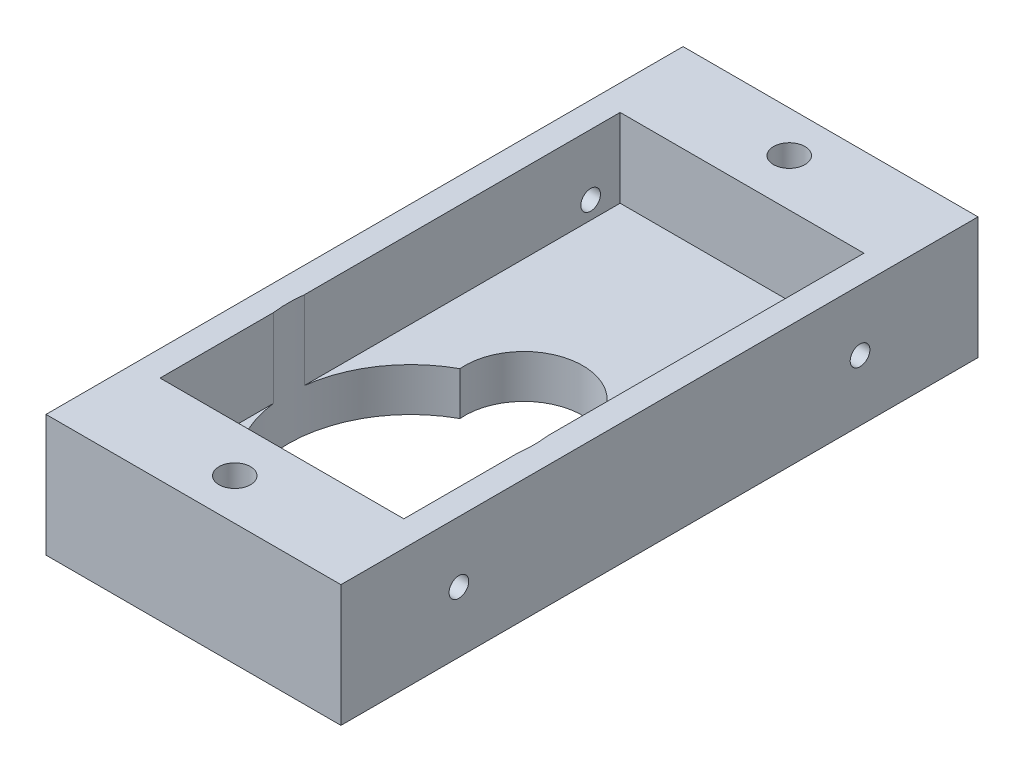
from build123d import *
from build123d.topology import SkipClean

# Parameters (mm, degrees)
SKETCH_1_W          = 15
SKETCH_1_H          = 32.4
SKETCH_1_R          = 0.8
EXTRUDE_1_DEPTH     = 2.2
SKETCH_1_3_R        = 6.25
SKETCH_1_3_R_2      = 3
CUT_EXTRUDE_1_DEPTH = 36.771497033
SKETCH_2_W          = 15
SKETCH_2_H          = 32.4
EXTRUDE_2_DEPTH     = 4
SKETCH_3_R          = 0.8
CUT_EXTRUDE_2_DEPTH = 3
SKETCH_4_R          = 0.5
CUT_EXTRUDE_3_DEPTH = 37.238101496


with BuildPart() as part:
    # 草图1 → 凸台-拉伸1 (new body)
    with BuildSketch(Plane(origin=(0, 0, 0), x_dir=(1, 0, 0), z_dir=(0, 1, 0))):
        with Locations((7.5, -16.2)):
            Rectangle(SKETCH_1_W, SKETCH_1_H)
        with Locations((3, -3)):
            Circle(SKETCH_1_R, mode=Mode.SUBTRACT)
        with Locations((12, -3)):
            Circle(SKETCH_1_R, mode=Mode.SUBTRACT)
        with Locations((3, -29.4)):
            Circle(SKETCH_1_R, mode=Mode.SUBTRACT)
        with Locations((12, -29.4)):
            Circle(SKETCH_1_R, mode=Mode.SUBTRACT)
    extrude(amount=EXTRUDE_1_DEPTH)

    # 草图1<3> → 切除-拉伸1 (cut, through all)
    with BuildSketch(Plane(origin=(0, 0, 0), x_dir=(1, 0, 0), z_dir=(0, 1, 0))):
        with Locations((7.5, -21.35)):
            Circle(SKETCH_1_3_R)
        with Locations((7.5, -15.6)):
            Circle(SKETCH_1_3_R_2)
    extrude(amount=CUT_EXTRUDE_1_DEPTH, mode=Mode.SUBTRACT)

    # 草图2 → 凸台-拉伸2 (add)
    with SkipClean():  # the faces are left unmerged after this step: merging them gives an invalid solid
        with BuildSketch(Plane(origin=(0, 2.2, 0), x_dir=(1, 0, 0), z_dir=(0, 1, 0))):
            with Locations((7.5, -16.2)):
                Rectangle(SKETCH_2_W, SKETCH_2_H)
            with BuildLine():
                Line((13.7, -27.9), (1.3, -27.9))
                Line((1.3, -27.9), (1.3, -22.138986692))
                ThreePointArc((1.3, -22.138986692), (1.25, -21.35), (1.3, -20.561013308))
                Line((1.3, -20.561013308), (1.3, -4.5))
                Line((1.3, -4.5), (13.7, -4.5))
                Line((13.7, -4.5), (13.7, -20.561013308))
                ThreePointArc((13.7, -20.561013308), (13.75, -21.35), (13.7, -22.138986692))
                Line((13.7, -22.138986692), (13.7, -27.9))
            make_face(mode=Mode.SUBTRACT)
        extrude(amount=EXTRUDE_2_DEPTH)

    # 草图3 → 切除-拉伸2 (cut)
    with SkipClean():  # the faces are left unmerged after this step: merging them gives an invalid solid
        with BuildSketch(Plane(origin=(0, 6.2, 0), x_dir=(1, 0, 0), z_dir=(0, 1, 0))):
            with Locations((7.5, -30.3)):
                Circle(SKETCH_3_R)
            with Locations((7.5, -2.1)):
                Circle(SKETCH_3_R)
        extrude(amount=-CUT_EXTRUDE_2_DEPTH, mode=Mode.SUBTRACT)

    # 草图4 → 切除-拉伸3 (cut, through all)
    with SkipClean():  # the faces are left unmerged after this step: merging them gives an invalid solid
        with BuildSketch(Plane.ZY):
            with Locations((6, 3.1)):
                Circle(SKETCH_4_R)
            with Locations((26.4, 3.1)):
                Circle(SKETCH_4_R)
        extrude(amount=-CUT_EXTRUDE_3_DEPTH, mode=Mode.SUBTRACT)


solid = part.part
